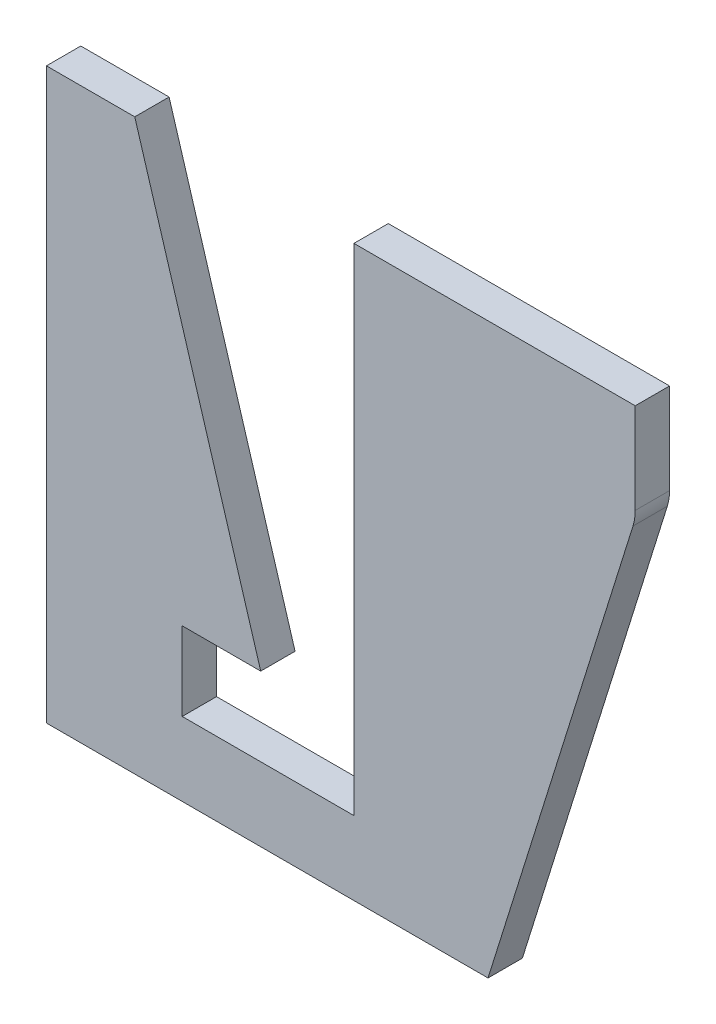
from build123d import *

# Parameters (mm, degrees)
EXTRUDE_1_DEPTH = 7
FILLET_1_R      = 10


with BuildPart() as part:
    # 草图1 → 凸台-拉伸1 (new body)
    with BuildSketch(Plane.XY):
        Polygon((-79.488423121, 60.813672833), (-61.488423121, 60.813672833), (-35.816291974, -24.186327167), (-51.816291974, -24.186327167), (-51.816291974, -40.186327167), (-16.816291974, -40.186327167), (-16.816291974, 60.813672833), (40.511576879, 60.813672833), (40.511576879, 40.813672833), (10.511576879, -55.186327167), (-79.488423121, -55.186327167), align=None)
    extrude(amount=EXTRUDE_1_DEPTH)

    # 圆角1
    fillet_1_edges = [part.edges().sort_by_distance(p)[0] for p in [
        (40.511576879, 40.813672833, 3.5),
    ]]
    fillet(fillet_1_edges, radius=FILLET_1_R)


solid = part.part
